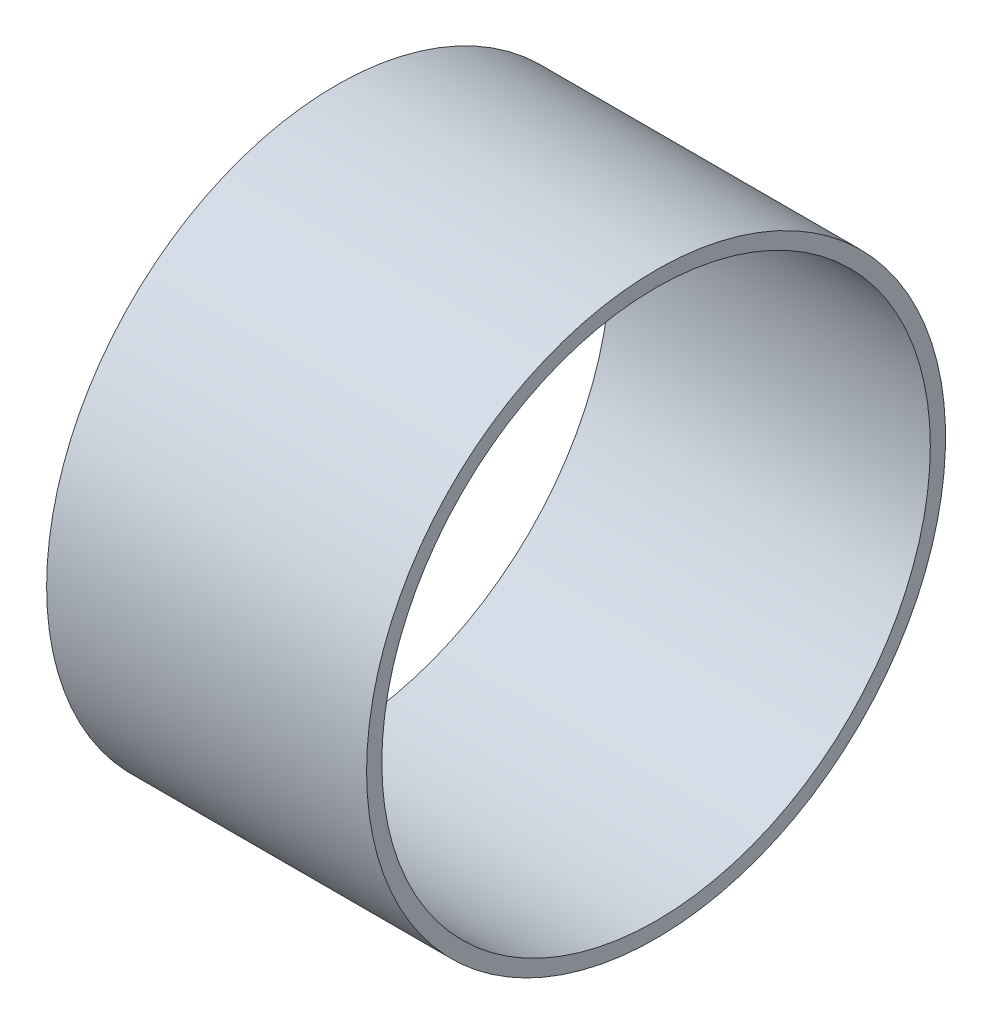
from build123d import *

# Parameters (mm, degrees)
ESQUISSE1_W = 42
ESQUISSE1_H = 2


with BuildPart() as part:
    # Esquisse1 → Révolution1 (revolve)
    with BuildSketch(Plane(origin=(0, 0, 0), x_dir=(-1, 0, 0), z_dir=(0, 0, -1)), mode=Mode.PRIVATE) as r_volution1_sk:
        with Locations((-21, 37)):
            Rectangle(ESQUISSE1_W, ESQUISSE1_H)
    revolve(r_volution1_sk.sketch.rotate(Axis((42, 0, 0), (-1, 0, 0)), 270), axis=Axis((42, 0, 0), (-1, 0, 0)))


solid = part.part
